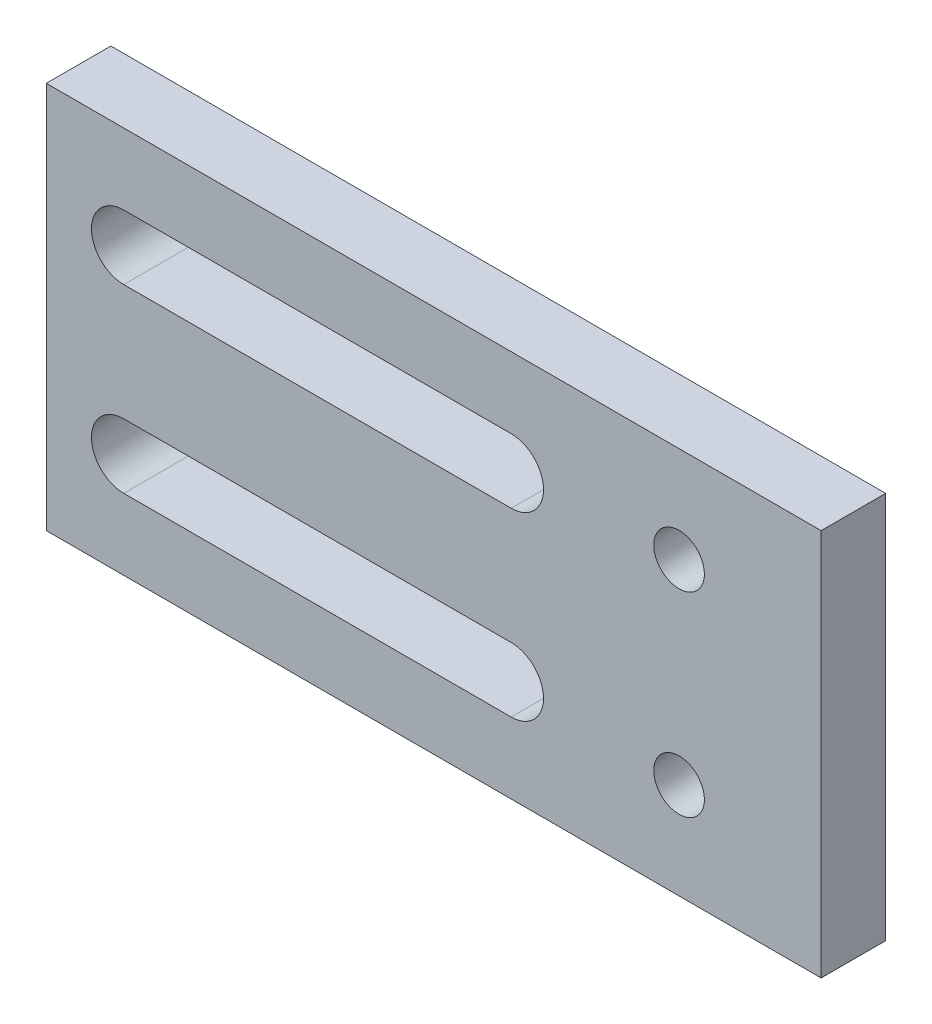
from build123d import *

# Parameters (mm, degrees)
SKETCH1_W           = 38.1
SKETCH1_H           = 19.05
SKETCH1_R           = 1.2446
BOSS_EXTRUDE1_DEPTH = 3.175


with BuildPart() as part:
    # Sketch1 → Boss-Extrude1 (new body)
    with BuildSketch(Plane.XY):
        Rectangle(SKETCH1_W, SKETCH1_H)
        with BuildLine():
            Line((-15.24, -2.8575), (3.81, -2.8575))
            ThreePointArc((3.81, -2.8575), (5.3975, -4.445), (3.81, -6.0325))
            Line((3.81, -6.0325), (-15.24, -6.0325))
            ThreePointArc((-15.24, -6.0325), (-16.8275, -4.445), (-15.24, -2.8575))
        make_face(mode=Mode.SUBTRACT)
        with Locations((12.065, -4.8006)):
            Circle(SKETCH1_R, mode=Mode.SUBTRACT)
        with Locations((12.065, 4.8006)):
            Circle(SKETCH1_R, mode=Mode.SUBTRACT)
        with BuildLine():
            ThreePointArc((3.81, 6.0325), (5.3975, 4.445), (3.81, 2.8575))
            Line((3.81, 2.8575), (-15.24, 2.8575))
            ThreePointArc((-15.24, 2.8575), (-16.8275, 4.445), (-15.24, 6.0325))
            Line((-15.24, 6.0325), (3.81, 6.0325))
        make_face(mode=Mode.SUBTRACT)
    extrude(amount=BOSS_EXTRUDE1_DEPTH)


solid = part.part
